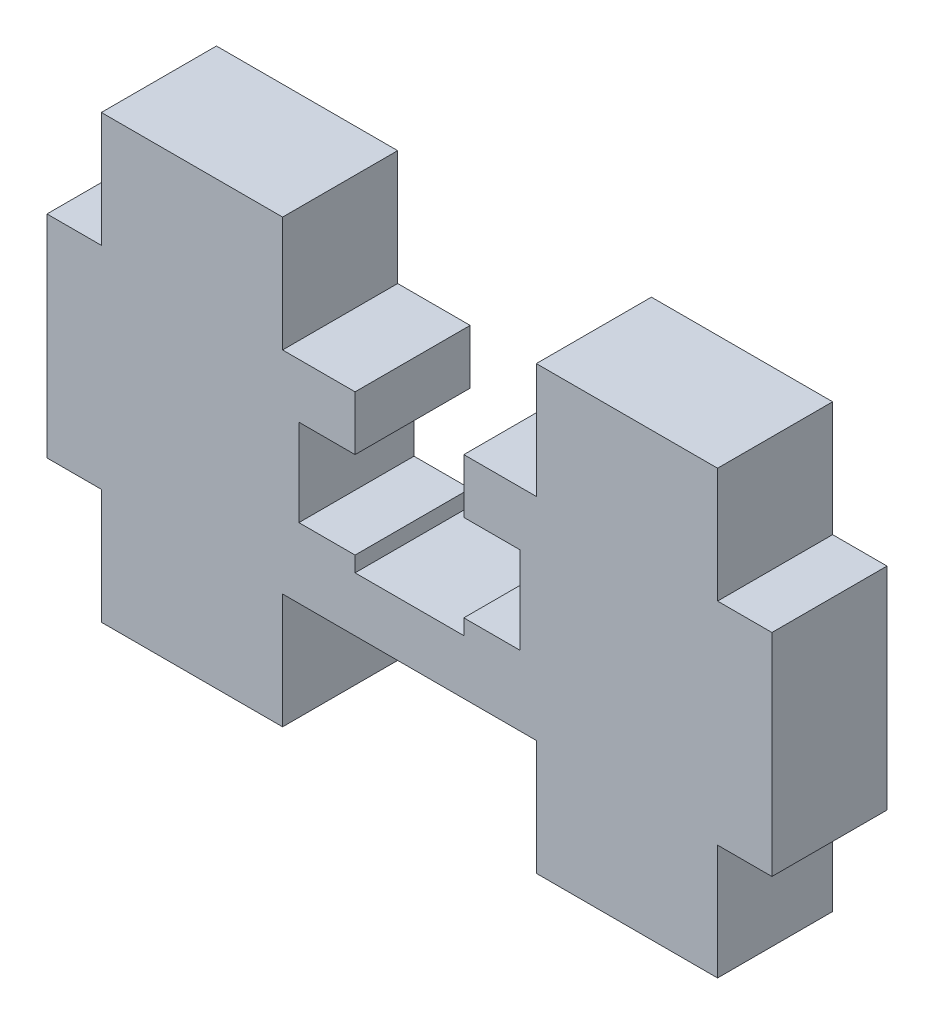
from build123d import *

# Parameters (mm, degrees)
BOSS_EXTRUDE1_DEPTH = 3.175
CUT_EXTRUDE1_DEPTH  = 13.131311759


with BuildPart() as part:
    # Sketch1 → Boss-Extrude1 (new body)
    with BuildSketch(Plane.XY):
        Polygon((-10, 2.915), (-10, -2.915), (-8.5, -2.915), (-8.5, -6.09), (-3.5, -6.09), (-3.5, -2.915), (3.5, -2.915), (3.5, -6.09), (8.5, -6.09), (8.5, -2.915), (10, -2.915), (10, 2.915), (8.5, 2.915), (8.5, 6.09), (3.5, 6.09), (3.5, 2.915), (-3.5, 2.915), (-3.5, 6.09), (-8.5, 6.09), (-8.5, 2.915), align=None)
    extrude(amount=BOSS_EXTRUDE1_DEPTH)

    # Sketch2 → Cut-Extrude1 (cut, through all)
    with BuildSketch(Plane.XY.offset(3.175)):
        Polygon((-1.5, 2.915), (-1.5, 1.415), (-3.05, 1.415), (-3.05, -0.985), (-1.5, -0.985), (-1.5, -1.41), (1.5, -1.41), (1.5, -0.985), (3.05, -0.985), (3.05, 1.415), (1.5, 1.415), (1.5, 2.915), align=None)
    extrude(amount=-CUT_EXTRUDE1_DEPTH, mode=Mode.SUBTRACT)


solid = part.part
